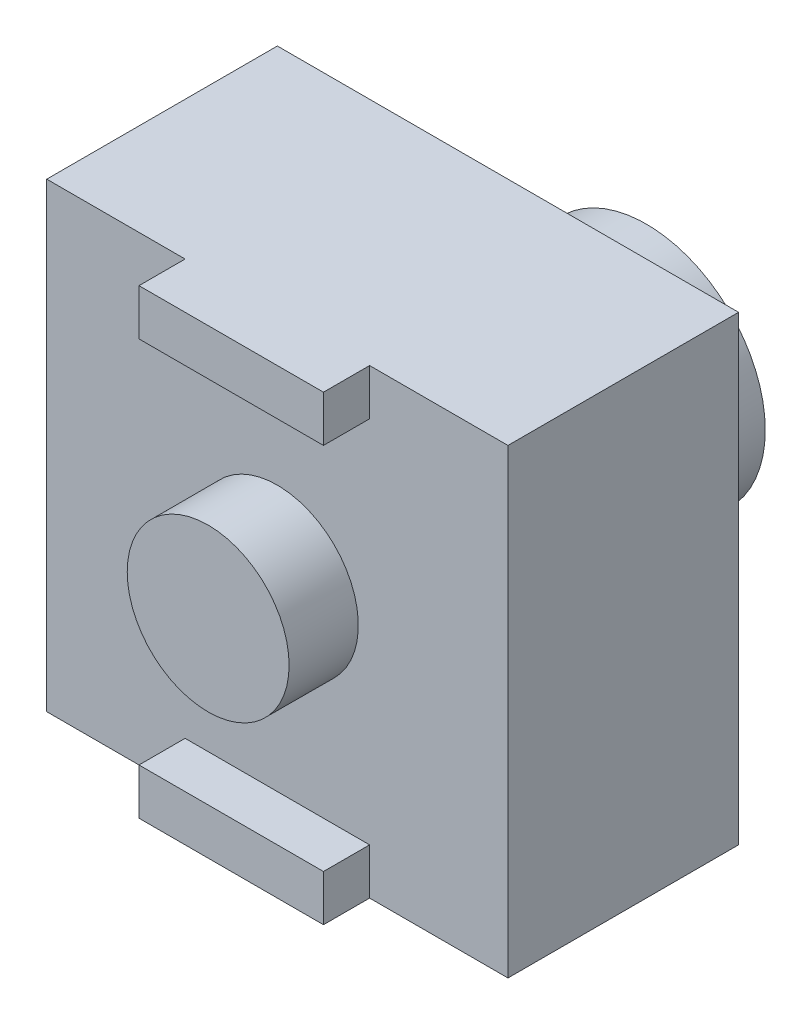
from build123d import *

# Parameters (mm, degrees)
SKETCH1_W           = 10
SKETCH1_H           = 10
BOSS_EXTRUDE1_DEPTH = 5
SKETCH2_R           = 2.5
CUT_EXTRUDE1_DEPTH  = 4
SKETCH3_R           = 1.755
CUT_EXTRUDE2_DEPTH  = 1
SKETCH4_R           = 2.57854844
BOSS_EXTRUDE2_DEPTH = 7
SKETCH5_R           = 1.755
BOSS_EXTRUDE3_DEPTH = 2.5
SKETCH6_W           = 4
SKETCH6_H           = 1
BOSS_EXTRUDE4_DEPTH = 1


with BuildPart() as part:
    # Sketch1 → Boss-Extrude1 (new body)
    with BuildSketch(Plane.XY):
        with Locations((5, 5)):
            Rectangle(SKETCH1_W, SKETCH1_H)
    extrude(amount=BOSS_EXTRUDE1_DEPTH)

    # Sketch2 → Cut-Extrude1 (cut)
    with BuildSketch(Plane(origin=(0, 0, 0), x_dir=(-1, 0, 0), z_dir=(0, 0, -1))):
        with Locations((-5, 5)):
            Circle(SKETCH2_R)
    extrude(amount=-CUT_EXTRUDE1_DEPTH, mode=Mode.SUBTRACT)

    # Sketch3 → Cut-Extrude2 (cut)
    with BuildSketch(Plane(origin=(0, 0, 4), x_dir=(-1, 0, 0), z_dir=(0, 0, -1))):
        with Locations((-5, 5)):
            Circle(SKETCH3_R)
    extrude(amount=-CUT_EXTRUDE2_DEPTH, mode=Mode.SUBTRACT)

    # Sketch4 → Boss-Extrude2 (add)
    with BuildSketch(Plane(origin=(0, 0, 4), x_dir=(-1, 0, 0), z_dir=(0, 0, -1))):
        with Locations((-5, 5.07854844)):
            Circle(SKETCH4_R)
    extrude(amount=BOSS_EXTRUDE2_DEPTH)

    # Sketch5 → Boss-Extrude3 (add)
    with BuildSketch(Plane.XY.offset(4)):
        with Locations(Location((5, 5, 0), (0, 0, 180))):
            Circle(SKETCH5_R)
    extrude(amount=BOSS_EXTRUDE3_DEPTH)

    # Sketch6 → Boss-Extrude4 (add)
    with BuildSketch(Plane.XY.offset(5)):
        with Locations((5, 9.5)):
            Rectangle(SKETCH6_W, SKETCH6_H)
    boss_extrude4 = extrude(amount=BOSS_EXTRUDE4_DEPTH)

    # Mirror1: Boss-Extrude4 across plane
    add(boss_extrude4.mirror(Plane(origin=(0, 5, 0), x_dir=(0, 0, 1), z_dir=(0, -1, 0))))


solid = part.part
